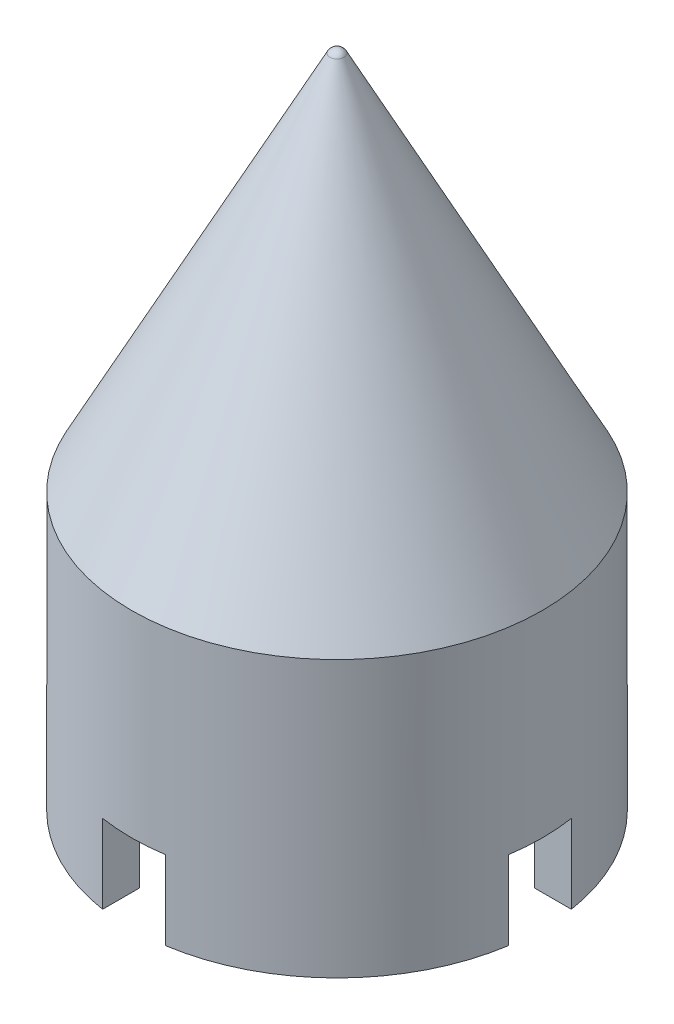
from build123d import *

# Parameters (mm, degrees)
SKETCH1_R           = 10.425
SKETCH1_R_2         = 8.575
BOSS_EXTRUDE1_DEPTH = 14
SKETCH1_2_R         = 8.575
BOSS_EXTRUDE2_DEPTH = 14
SKETCH1_3_R         = 8.575
CUT_EXTRUDE1_DEPTH  = 4
CUT_EXTRUDE3_START  = 4
CUT_EXTRUDE3_DEPTH  = 4


with BuildPart() as part:
    # Sketch1 → Boss-Extrude1 (new body)
    with BuildSketch(Plane(origin=(0, 0, 0), x_dir=(1, 0, 0), z_dir=(0, 1, 0))):
        Circle(SKETCH1_R)
        Circle(SKETCH1_R_2, mode=Mode.SUBTRACT)
    extrude(amount=BOSS_EXTRUDE1_DEPTH)

    # Sketch1<2> → Boss-Extrude2 (add)
    with BuildSketch(Plane(origin=(0, 0, 0), x_dir=(1, 0, 0), z_dir=(0, 1, 0))):
        Circle(SKETCH1_2_R)
    extrude(amount=BOSS_EXTRUDE2_DEPTH)

    # Sketch1<3> → Cut-Extrude1 (cut)
    with BuildSketch(Plane(origin=(0, 0, 0), x_dir=(1, 0, 0), z_dir=(0, 1, 0))):
        Circle(SKETCH1_3_R)
    extrude(amount=CUT_EXTRUDE1_DEPTH, mode=Mode.SUBTRACT)

    # Sketch2 → Cut-Extrude3 (cut)
    with BuildSketch(Plane.XZ.offset(-4).offset(CUT_EXTRUDE3_START)):
        with BuildLine():
            Line((-1.6, -8.424406507), (-1.6, -11.258312908))
            Line((-1.6, -11.258312908), (1.6, -11.258312908))
            Line((1.6, -11.258312908), (1.6, -8.424406507))
            ThreePointArc((1.6, -8.424406507), (0, -8.575), (-1.6, -8.424406507))
        make_face()
        with BuildLine():
            Line((-10.902270297, -1.6), (-8.424406507, -1.6))
            ThreePointArc((-8.424406507, -1.6), (-8.575, 0), (-8.424406507, 1.6))
            Line((-8.424406507, 1.6), (-10.902270297, 1.6))
            Line((-10.902270297, 1.6), (-10.902270297, -1.6))
        make_face()
        with BuildLine():
            Line((-1.6, 10.963656954), (-1.6, 8.424406507))
            ThreePointArc((-1.6, 8.424406507), (-0.803535687, 8.537268615), (0, 8.575))
            ThreePointArc((0, 8.575), (0.803535687, 8.537268615), (1.6, 8.424406507))
            Line((1.6, 8.424406507), (1.6, 10.963656954))
            Line((1.6, 10.963656954), (-1.6, 10.963656954))
        make_face()
        with BuildLine():
            ThreePointArc((8.424406507, 1.6), (8.575, 0), (8.424406507, -1.6))
            Line((8.424406507, -1.6), (11.025043611, -1.6))
            Line((11.025043611, -1.6), (11.025043611, 1.6))
            Line((11.025043611, 1.6), (8.424406507, 1.6))
        make_face()
    extrude(amount=-CUT_EXTRUDE3_DEPTH, mode=Mode.SUBTRACT)

    # Sketch4 → Revolve4 (revolve)
    with BuildSketch(Plane(origin=(0, 0, 0), x_dir=(0, 0, -1), z_dir=(1, 0, 0))):
        with BuildLine():
            Line((0.364875, 33.3), (10.425, 14))
            Line((10.425, 14), (0, 14))
            Line((0, 14), (0, 33.521277517))
            ThreePointArc((0, 33.521277517), (0.213364421, 33.461635627), (0.364875, 33.3))
        make_face()
    revolve(axis=Axis((0, 14, 0), (0, 1, 0)))


solid = part.part
